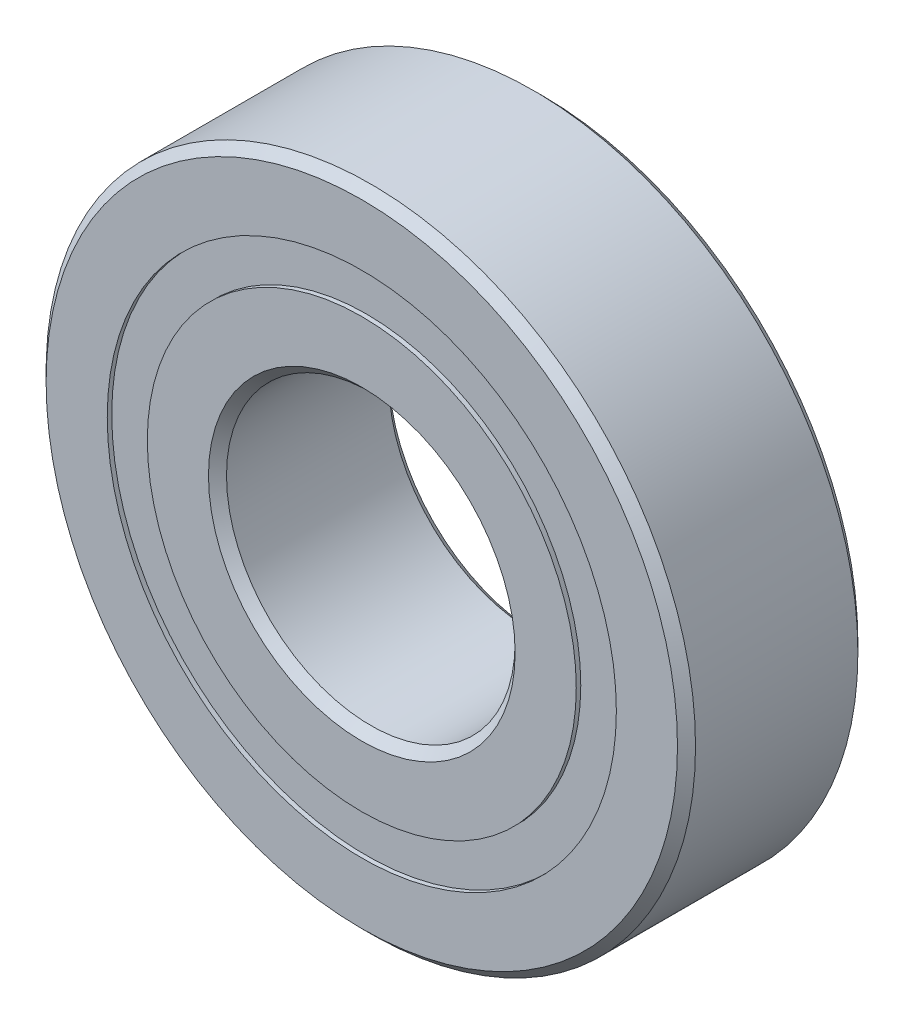
from build123d import *

# Parameters (mm, degrees)
CIRPATTERN1_COUNT = 15
SKETCH5_W         = 0.566370006
SKETCH5_H         = 0.555555556


with BuildPart() as part:
    # Sketch1 → Revolve1 (revolve)
    with BuildSketch(Plane(origin=(0, 0, 0), x_dir=(0, 0, -1), z_dir=(1, 0, 0))):
        with BuildLine():
            Line((1.125, 4.5), (-1.125, 4.5))
            Line((-1.125, 4.5), (-1.25, 4.375))
            Line((-1.25, 4.375), (-1.25, 3.527777778))
            Line((-1.25, 3.527777778), (-0.555555556, 3.527777778))
            ThreePointArc((-0.555555556, 3.527777778), (0, 3.871129994), (0.555555556, 3.527777778))
            Line((0.555555556, 3.527777778), (1.25, 3.527777778))
            Line((1.25, 3.527777778), (1.25, 4.375))
            Line((1.25, 4.375), (1.125, 4.5))
        make_face()
    revolve(axis=Axis((0, 0, 1.25), (0, 0, -1)))


with BuildPart() as body_2:
    # Sketch2 → Revolve2 (revolve)
    with BuildSketch(Plane(origin=(0, 0, 0), x_dir=(0, 0, -1), z_dir=(1, 0, 0))):
        with BuildLine():
            Line((-1.25, 2.972222222), (-0.555555556, 2.972222222))
            ThreePointArc((-0.555555556, 2.972222222), (0, 2.628870006), (0.555555556, 2.972222222))
            Line((0.555555556, 2.972222222), (1.25, 2.972222222))
            Line((1.25, 2.972222222), (1.25, 2.125))
            Line((1.25, 2.125), (1.125, 2))
            Line((1.125, 2), (-1.125, 2))
            Line((-1.125, 2), (-1.25, 2.125))
            Line((-1.25, 2.125), (-1.25, 2.972222222))
        make_face()
    revolve(axis=Axis((0, 0, 1.25), (0, 0, -1)))


with BuildPart() as body_3:
    # Sketch3 → Revolve3 (revolve)
    with BuildSketch(Plane(origin=(0, 0, 0), x_dir=(0, 0, -1), z_dir=(1, 0, 0))):
        with BuildLine():
            Line((-0.621129994, 3.25), (0.621129994, 3.25))
            ThreePointArc((0.621129994, 3.25), (0, 3.871129994), (-0.621129994, 3.25))
        make_face()
    revolve(axis=Axis((0, 3.25, 0.621129994), (0, 0, -1)))


with BuildPart() as cirpattern1_1:
    # CirPattern1: pattern copy
    add(body_3.part.rotate(Axis((0, 0, -1.25), (0, 0, 1)), 1 * 360 / CIRPATTERN1_COUNT))


with BuildPart() as cirpattern1_2:
    # CirPattern1: pattern copy
    add(body_3.part.rotate(Axis((0, 0, -1.25), (0, 0, 1)), 2 * 360 / CIRPATTERN1_COUNT))


with BuildPart() as cirpattern1_3:
    # CirPattern1: pattern copy
    add(body_3.part.rotate(Axis((0, 0, -1.25), (0, 0, 1)), 3 * 360 / CIRPATTERN1_COUNT))


with BuildPart() as cirpattern1_4:
    # CirPattern1: pattern copy
    add(body_3.part.rotate(Axis((0, 0, -1.25), (0, 0, 1)), 4 * 360 / CIRPATTERN1_COUNT))


with BuildPart() as cirpattern1_5:
    # CirPattern1: pattern copy
    add(body_3.part.rotate(Axis((0, 0, -1.25), (0, 0, 1)), 5 * 360 / CIRPATTERN1_COUNT))


with BuildPart() as cirpattern1_6:
    # CirPattern1: pattern copy
    add(body_3.part.rotate(Axis((0, 0, -1.25), (0, 0, 1)), 6 * 360 / CIRPATTERN1_COUNT))


with BuildPart() as cirpattern1_7:
    # CirPattern1: pattern copy
    add(body_3.part.rotate(Axis((0, 0, -1.25), (0, 0, 1)), 7 * 360 / CIRPATTERN1_COUNT))


with BuildPart() as cirpattern1_8:
    # CirPattern1: pattern copy
    add(body_3.part.rotate(Axis((0, 0, -1.25), (0, 0, 1)), 8 * 360 / CIRPATTERN1_COUNT))


with BuildPart() as cirpattern1_9:
    # CirPattern1: pattern copy
    add(body_3.part.rotate(Axis((0, 0, -1.25), (0, 0, 1)), 9 * 360 / CIRPATTERN1_COUNT))


with BuildPart() as cirpattern1_10:
    # CirPattern1: pattern copy
    add(body_3.part.rotate(Axis((0, 0, -1.25), (0, 0, 1)), 10 * 360 / CIRPATTERN1_COUNT))


with BuildPart() as cirpattern1_11:
    # CirPattern1: pattern copy
    add(body_3.part.rotate(Axis((0, 0, -1.25), (0, 0, 1)), 11 * 360 / CIRPATTERN1_COUNT))


with BuildPart() as cirpattern1_12:
    # CirPattern1: pattern copy
    add(body_3.part.rotate(Axis((0, 0, -1.25), (0, 0, 1)), 12 * 360 / CIRPATTERN1_COUNT))


with BuildPart() as cirpattern1_13:
    # CirPattern1: pattern copy
    add(body_3.part.rotate(Axis((0, 0, -1.25), (0, 0, 1)), 13 * 360 / CIRPATTERN1_COUNT))


with BuildPart() as cirpattern1_14:
    # CirPattern1: pattern copy
    add(body_3.part.rotate(Axis((0, 0, -1.25), (0, 0, 1)), 14 * 360 / CIRPATTERN1_COUNT))


with BuildPart() as body_18:
    # Sketch5 → Revolve5 (revolve)
    with BuildSketch(Plane(origin=(0, 0, 0), x_dir=(0, 0, -1), z_dir=(1, 0, 0))):
        with Locations((-0.904314997, 3.25)):
            Rectangle(SKETCH5_W, SKETCH5_H)
        with Locations((0.904314997, 3.25)):
            Rectangle(SKETCH5_W, SKETCH5_H)
    revolve(axis=Axis((0, 0, 1.25), (0, 0, -1)))


solid = Compound([part.part, body_2.part, body_3.part, cirpattern1_1.part, cirpattern1_2.part, cirpattern1_3.part, cirpattern1_4.part, cirpattern1_5.part, cirpattern1_6.part, cirpattern1_7.part, cirpattern1_8.part, cirpattern1_9.part, cirpattern1_10.part, cirpattern1_11.part, cirpattern1_12.part, cirpattern1_13.part, cirpattern1_14.part, body_18.part])
